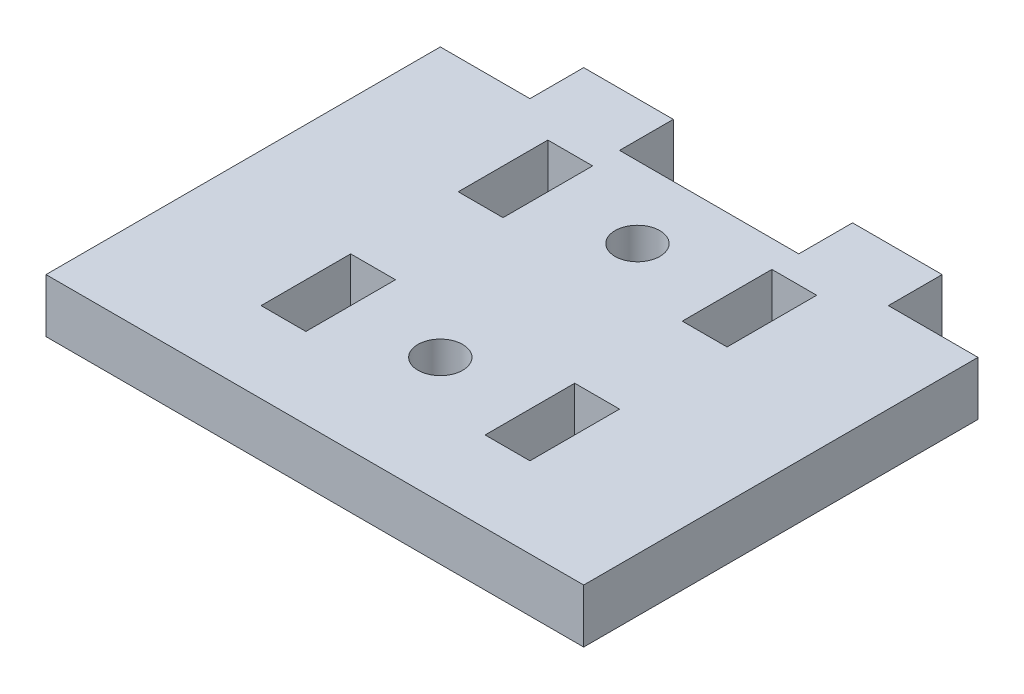
from build123d import *

# Parameters (mm, degrees)
SKETCH2_R           = 2.5
SKETCH2_W           = 5
SKETCH2_H           = 10
BOSS_EXTRUDE1_DEPTH = 6


with BuildPart() as part:
    # Sketch2 → Boss-Extrude1 (new body)
    with BuildSketch(Plane(origin=(0, 0, 0), x_dir=(1, 0, 0), z_dir=(0, 1, 0))):
        Polygon((-27.923792882, 25.284964835), (-17.923792882, 25.284964835), (-17.923792882, 31.284964835), (-7.923792882, 31.284964835), (-7.923792882, 25.284964835), (12.076207118, 25.284964835), (12.076207118, 31.284964835), (22.076207118, 31.284964835), (22.076207118, 25.284964835), (32.076207118, 25.284964835), (32.076207118, -18.715035165), (-27.923792882, -18.715035165), align=None)
        with Locations(Location((2.076207118, 17.284964835, 0), (0, 0, 270))):
            Circle(SKETCH2_R, mode=Mode.SUBTRACT)
        with Locations(Location((2.076207118, -4.715035165, 0), (0, 0, 270))):
            Circle(SKETCH2_R, mode=Mode.SUBTRACT)
        with Locations((-10.423792882, -4.715035165)):
            Rectangle(SKETCH2_W, SKETCH2_H, mode=Mode.SUBTRACT)
        with Locations((-10.423792882, 17.284964835)):
            Rectangle(SKETCH2_W, SKETCH2_H, mode=Mode.SUBTRACT)
        with Locations((14.576207118, 17.284964835)):
            Rectangle(SKETCH2_W, SKETCH2_H, mode=Mode.SUBTRACT)
        with Locations((14.576207118, -4.715035165)):
            Rectangle(SKETCH2_W, SKETCH2_H, mode=Mode.SUBTRACT)
    extrude(amount=BOSS_EXTRUDE1_DEPTH)


solid = part.part
